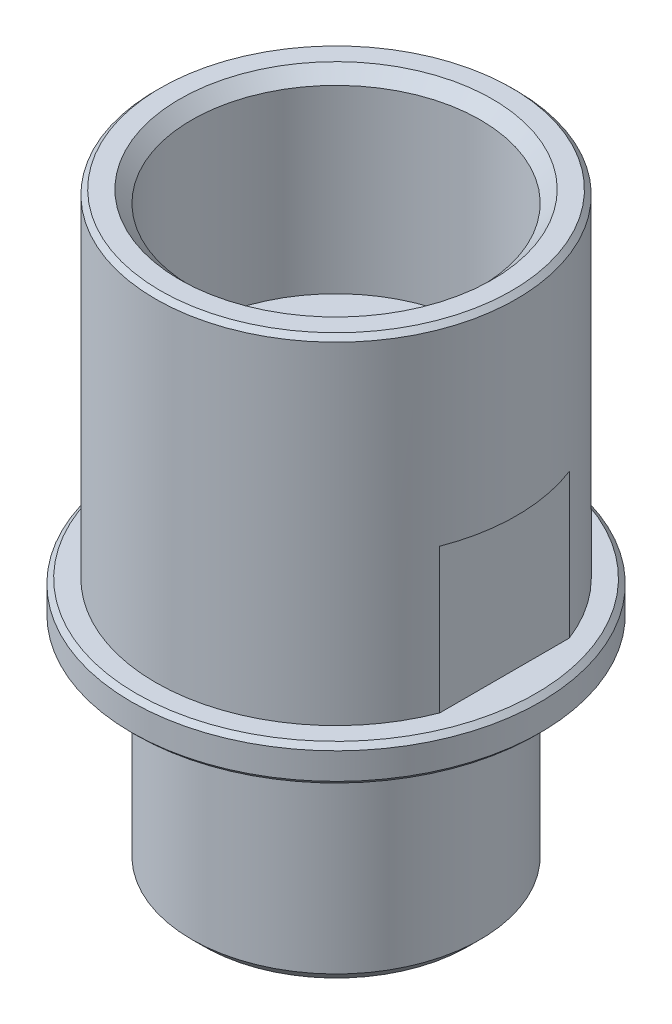
from build123d import *

# Parameters (mm, degrees)
SKIZZE1_R             = 8.5
GK_DEPTH              = 15.5
CUT_EXTRUDE_START     = -14
SKIZZE2_R             = 8.5
SKIZZE2_R_2           = 7.5
CUT_EXTRUDE_D15_DEPTH = 14
SKIZZE3_W             = 15
SKIZZE3_H             = 6
SW14_DEPTH            = 0.5
SKIZZE4_R             = 6
AU_ENGEWINDE_DEPTH    = 9
SKIZZE18_R            = 4.65
D9_3MM_DEPTH          = 28.290108098
SKIZZE19_R            = 6
KERNLOCH_D12_DEPTH    = 8
FASE_0_2MM_SIZE       = 0.2
FASE_0_5MM_SIZE       = 0.5


with BuildPart() as part:
    # Skizze1 → GK (new body)
    with BuildSketch(Plane(origin=(0, 0, 0), x_dir=(1, 0, 0), z_dir=(0, 1, 0))):
        with Locations(Location((0, 0, 0), (0, 0, 270))):
            Circle(SKIZZE1_R)
    extrude(amount=GK_DEPTH)

    # Skizze2 → D15 (cut)
    with BuildSketch(Plane(origin=(0, 15.5, 0), x_dir=(1, 0, 0), z_dir=(0, 1, 0)).offset(CUT_EXTRUDE_START)):
        with Locations(Location((0, 0, 0), (0, 0, 270))):
            Circle(SKIZZE2_R)
        with Locations(Location((0, 0, 0), (0, 0, 270))):
            Circle(SKIZZE2_R_2, mode=Mode.SUBTRACT)
    extrude(amount=CUT_EXTRUDE_D15_DEPTH, mode=Mode.SUBTRACT)

    # Skizze3 → SW14 (cut)
    with BuildSketch(Plane(origin=(7.5, 0, 0), x_dir=(0, 0, -1), z_dir=(1, 0, 0))):
        with Locations((0, 4.5)):
            Rectangle(SKIZZE3_W, SKIZZE3_H)
    sw14 = extrude(amount=-SW14_DEPTH, mode=Mode.SUBTRACT)

    # Spiegeln1: SW14 across plane
    add(sw14.mirror(Plane(origin=(0, 0, 0), x_dir=(0, 0, 1), z_dir=(1, 0, 0))), mode=Mode.SUBTRACT)

    # Skizze4 → Außengewinde (add)
    with BuildSketch(Plane.XZ):
        with Locations(Location((0, 0, 0), (0, 0, 270))):
            Circle(SKIZZE4_R)
    extrude(amount=AU_ENGEWINDE_DEPTH)

    # Skizze18 → D9,3mm (cut, through all)
    with BuildSketch(Plane.XZ.offset(9)):
        with Locations(Location((0, 0, 0), (0, 0, 270))):
            Circle(SKIZZE18_R)
    extrude(amount=-D9_3MM_DEPTH, mode=Mode.SUBTRACT)

    # Skizze19 → Kernloch D12 (cut)
    with BuildSketch(Plane(origin=(0, 15.5, 0), x_dir=(1, 0, 0), z_dir=(0, 1, 0))):
        with Locations(Location((0, 0, 0), (0, 0, 90))):
            Circle(SKIZZE19_R)
    extrude(amount=-KERNLOCH_D12_DEPTH, mode=Mode.SUBTRACT)

    # Fase 0,2mm
    fase_0_2mm_edges = [part.edges().sort_by_distance(p)[0] for p in [
        (0, 0, -8.5),
        (0, 1.5, -8.5),
        (0, 15.5, -7.5),
    ]]
    chamfer(fase_0_2mm_edges, length=FASE_0_2MM_SIZE)

    # Fase 0,5mm
    fase_0_5mm_edges = [part.edges().sort_by_distance(p)[0] for p in [
        (0, -9, 6),
        (0, 15.5, 6),
    ]]
    chamfer(fase_0_5mm_edges, length=FASE_0_5MM_SIZE)


solid = part.part
